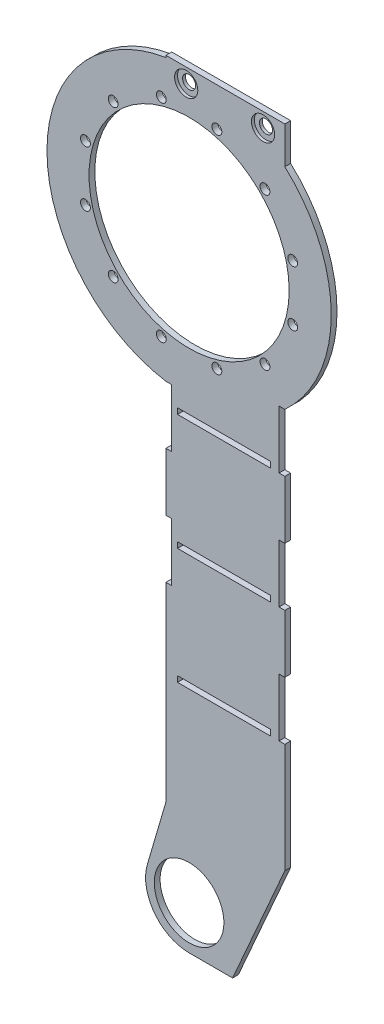
from build123d import *

# Parameters (mm, degrees)
SKETCH_1_R                   = 12
SKETCH_1_W                   = 32
SKETCH_1_H                   = 2
SKETCH_1_R_2                 = 1.7
SKETCH_1_R_3                 = 34.5
EXTRUDE_1_DEPTH              = 2
HOLE_WIZARD_M4_1_D           = 4.5
HOLE_WIZARD_M4_1_CBORE_D     = 8
HOLE_WIZARD_M4_1_CBORE_DEPTH = 1


with BuildPart() as part:
    # 草图1 → 凸台-拉伸1 (new body)
    with BuildSketch(Plane.XY):
        with BuildLine():
            ThreePointArc((-8, 48.342527861), (-49, 0), (-8, -48.342527861))
            Line((-8, -48.342527861), (-6, -48.342527861))
            Line((-6, -48.342527861), (-6, -68.342527861))
            Line((-6, -68.342527861), (-8, -68.342527861))
            Line((-8, -68.342527861), (-8, -88.342527861))
            Line((-8, -88.342527861), (-6, -88.342527861))
            Line((-6, -88.342527861), (-6, -108.342527861))
            Line((-6, -108.342527861), (-8, -108.342527861))
            Line((-8, -108.342527861), (-8, -128.342527861))
            Line((-8, -128.342527861), (-8, -174))
            Line((-8, -174), (-14.392579, -195.774639692))
            ThreePointArc((-14.392579, -195.774639692), (-12.007922481, -208.989426995), (0, -215))
            Line((0, -215), (15, -215))
            Line((15, -215), (33, -174))
            Line((33, -174), (33, -136.221540553))
            Line((33, -136.221540553), (31, -136.221540553))
            Line((31, -136.221540553), (31, -116.221540553))
            Line((31, -116.221540553), (33, -116.221540553))
            Line((33, -116.221540553), (33, -96.221540553))
            Line((33, -96.221540553), (31, -96.221540553))
            Line((31, -96.221540553), (31, -76.221540553))
            Line((31, -76.221540553), (33, -76.221540553))
            Line((33, -76.221540553), (33, -56.221540553))
            Line((33, -56.221540553), (31, -56.221540553))
            Line((31, -56.221540553), (31, -36.221540553))
            Line((31, -36.221540553), (33, -36.221540553))
            ThreePointArc((33, -36.221540553), (49, 0), (33, 36.221540553))
            Line((33, 36.221540553), (33, 49))
            Line((33, 49), (-8, 49))
            Line((-8, 49), (-8, 48.342527861))
        make_face()
        with Locations((0, -200)):
            Circle(SKETCH_1_R, mode=Mode.SUBTRACT)
        with Locations((12, -135.221540553)):
            Rectangle(SKETCH_1_W, SKETCH_1_H, mode=Mode.SUBTRACT)
        with Locations((12, -95.221540553)):
            Rectangle(SKETCH_1_W, SKETCH_1_H, mode=Mode.SUBTRACT)
        with Locations((-26.162950904, -26.162950904)):
            Circle(SKETCH_1_R_2, mode=Mode.SUBTRACT)
        with Locations((-9.576304669, -35.739255573)):
            Circle(SKETCH_1_R_2, mode=Mode.SUBTRACT)
        with Locations((-35.739255573, -9.576304669)):
            Circle(SKETCH_1_R_2, mode=Mode.SUBTRACT)
        with Locations((-35.739255573, 9.576304669)):
            Circle(SKETCH_1_R_2, mode=Mode.SUBTRACT)
        with Locations((-26.162950904, 26.162950904)):
            Circle(SKETCH_1_R_2, mode=Mode.SUBTRACT)
        Circle(SKETCH_1_R_3, mode=Mode.SUBTRACT)
        with Locations((-9.576304669, 35.739255573)):
            Circle(SKETCH_1_R_2, mode=Mode.SUBTRACT)
        with Locations((12, -55.221540553)):
            Rectangle(SKETCH_1_W, SKETCH_1_H, mode=Mode.SUBTRACT)
        with Locations((9.576304669, -35.739255573)):
            Circle(SKETCH_1_R_2, mode=Mode.SUBTRACT)
        with Locations((26.162950904, -26.162950904)):
            Circle(SKETCH_1_R_2, mode=Mode.SUBTRACT)
        with Locations((9.576304669, 35.739255573)):
            Circle(SKETCH_1_R_2, mode=Mode.SUBTRACT)
        with Locations((35.739255573, -9.576304669)):
            Circle(SKETCH_1_R_2, mode=Mode.SUBTRACT)
        with Locations((35.739255573, 9.576304669)):
            Circle(SKETCH_1_R_2, mode=Mode.SUBTRACT)
        with Locations((26.162950904, 26.162950904)):
            Circle(SKETCH_1_R_2, mode=Mode.SUBTRACT)
    extrude(amount=EXTRUDE_1_DEPTH)

    # M4 六角凹头盖的柱孔1 (through all)
    with Locations(Plane(origin=(-1, 44, 2), x_dir=(1, 0, 0), z_dir=(0, 0, 1))):
        with Locations((0, 0), (26.5, 0)):
            CounterBoreHole(HOLE_WIZARD_M4_1_D / 2, HOLE_WIZARD_M4_1_CBORE_D / 2, HOLE_WIZARD_M4_1_CBORE_DEPTH)


solid = part.part
